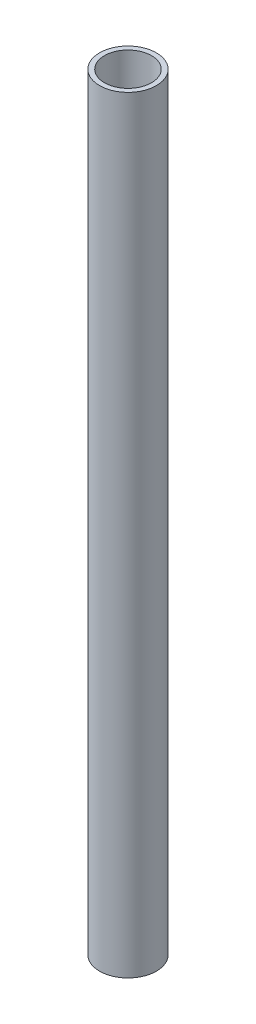
from build123d import *

# Parameters (mm, degrees)
SKETCH12_R                                   = 44.45
SKETCH12_R_2                                 = 36.83
RURA_GRUBO_CIENNA_X_WZMOCNIONA_S80_PIP_DEPTH = 1200


with BuildPart() as part:
    # Sketch12 → Rura grubościenna x; wzmocniona, s80 PIPE XS 3 SCH 80(1) (new body)
    with BuildSketch(Plane(origin=(0, 0, 0), x_dir=(1, 0, 0), z_dir=(0, 1, 0))):
        Circle(SKETCH12_R)
        Circle(SKETCH12_R_2, mode=Mode.SUBTRACT)
    extrude(amount=RURA_GRUBO_CIENNA_X_WZMOCNIONA_S80_PIP_DEPTH)


solid = part.part
